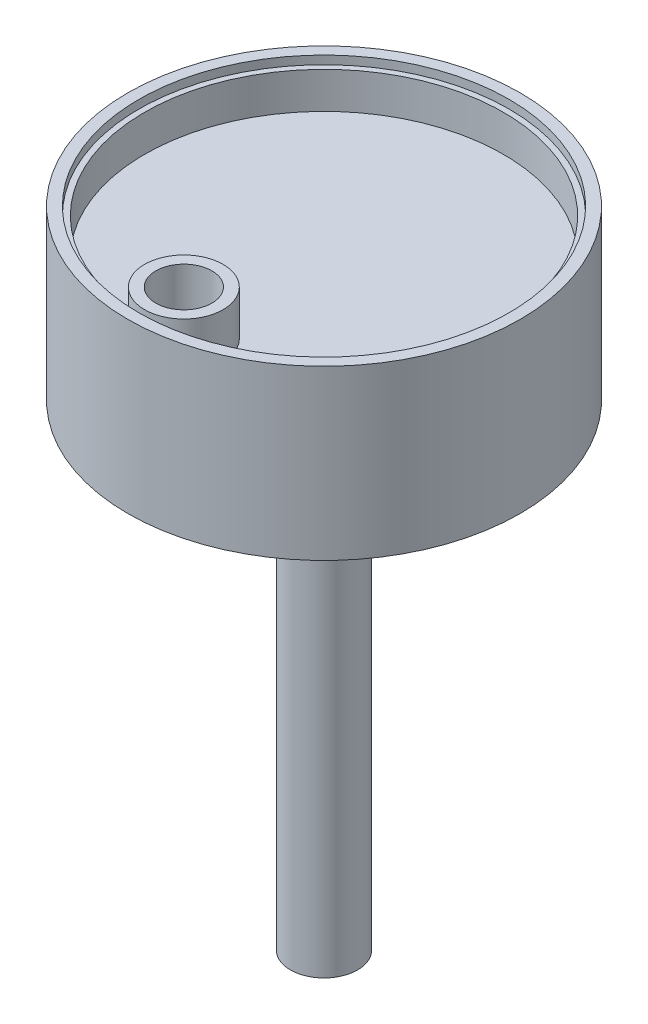
from build123d import *

# Parameters (mm, degrees)
SKETCH2_R            = 35
BOSS_EXTRUDE2_DEPTH  = 20
SKETCH3_R            = 32
CUT_EXTRUDE1_DEPTH   = 15
SKETCH4_R            = 6
BOSS_EXTRUDE3_DEPTH  = 100
SKETCH6_R            = 4
CUT_EXTRUDE3_DEPTH   = 95
SKETCH8_R            = 35
BOSS_EXTRUDE4_DEPTH  = 10
CUT_EXTRUDE4_START   = -8
SKETCH9_R            = 32
CUT_EXTRUDE4_DEPTH   = 8
SKETCH10_R           = 33
SKETCH10_R_2         = 31
CUT_EXTRUDE5_DEPTH   = 1.5
SKETCH11_R           = 5
CUT_EXTRUDE6_DEPTH   = 118.894020205
SKETCH13_R           = 7
SKETCH13_R_2         = 5
BOSS_EXTRUDE16_DEPTH = 8


with BuildPart() as part:
    # Sketch2 → Boss-Extrude2 (new body)
    with BuildSketch(Plane(origin=(0, 0, 0), x_dir=(1, 0, 0), z_dir=(0, 1, 0))):
        with Locations(Location((0, 0, 0), (0, 0, 270))):
            Circle(SKETCH2_R)
    extrude(amount=BOSS_EXTRUDE2_DEPTH)

    # Sketch3 → Cut-Extrude1 (cut)
    with BuildSketch(Plane.XZ):
        with Locations(Location((0, 0, 0), (0, 0, 270))):
            Circle(SKETCH3_R)
    extrude(amount=-CUT_EXTRUDE1_DEPTH, mode=Mode.SUBTRACT)

    # Sketch4 → Boss-Extrude3 (add)
    with BuildSketch(Plane.XZ.offset(-15)):
        with Locations(Location((0, 0, 0), (0, 0, 270))):
            Circle(SKETCH4_R)
    extrude(amount=BOSS_EXTRUDE3_DEPTH)

    # Sketch6 → Cut-Extrude3 (cut)
    with BuildSketch(Plane(origin=(0, 20, 0), x_dir=(1, 0, 0), z_dir=(0, 1, 0))):
        with Locations(Location((0, 0, 0), (0, 0, 270))):
            Circle(SKETCH6_R)
    extrude(amount=-CUT_EXTRUDE3_DEPTH, mode=Mode.SUBTRACT)

    # Sketch8 → Boss-Extrude4 (add)
    with BuildSketch(Plane(origin=(0, 20, 0), x_dir=(1, 0, 0), z_dir=(0, 1, 0))):
        with Locations(Location((0, 0, 0), (0, 0, 270))):
            Circle(SKETCH8_R)
    extrude(amount=BOSS_EXTRUDE4_DEPTH)

    # Sketch9 → Cut-Extrude4 (cut)
    with BuildSketch(Plane(origin=(0, 30, 0), x_dir=(1, 0, 0), z_dir=(0, 1, 0)).offset(CUT_EXTRUDE4_START)):
        with Locations(Location((0, 0, 0), (0, 0, 90))):
            Circle(SKETCH9_R)
    extrude(amount=CUT_EXTRUDE4_DEPTH, mode=Mode.SUBTRACT)

    # Sketch10 → Cut-Extrude5 (cut)
    with BuildSketch(Plane(origin=(0, 30, 0), x_dir=(1, 0, 0), z_dir=(0, 1, 0))):
        with Locations(Location((0, 0, 0), (0, 0, 270))):
            Circle(SKETCH10_R)
        Circle(SKETCH10_R_2, mode=Mode.SUBTRACT)
    extrude(amount=-CUT_EXTRUDE5_DEPTH, mode=Mode.SUBTRACT)

    # Sketch11 → Cut-Extrude6 (cut, through all)
    with BuildSketch(Plane(origin=(0, 22, 0), x_dir=(1, 0, 0), z_dir=(0, 1, 0))):
        with Locations(Location((0, -25, 0), (0, 0, 270))):
            Circle(SKETCH11_R)
    extrude(amount=-CUT_EXTRUDE6_DEPTH, mode=Mode.SUBTRACT)


with BuildPart() as body_2:
    # Sketch13 → Boss-Extrude16 (new body)
    with BuildSketch(Plane(origin=(0, 22, 0), x_dir=(1, 0, 0), z_dir=(0, 1, 0))):
        with Locations(Location((0, -25, 0), (0, 0, 270))):
            Circle(SKETCH13_R)
        with Locations(Location((0, -25, 0), (0, 0, 270))):
            Circle(SKETCH13_R_2, mode=Mode.SUBTRACT)
    extrude(amount=BOSS_EXTRUDE16_DEPTH)


solid = Compound([part.part, body_2.part])
